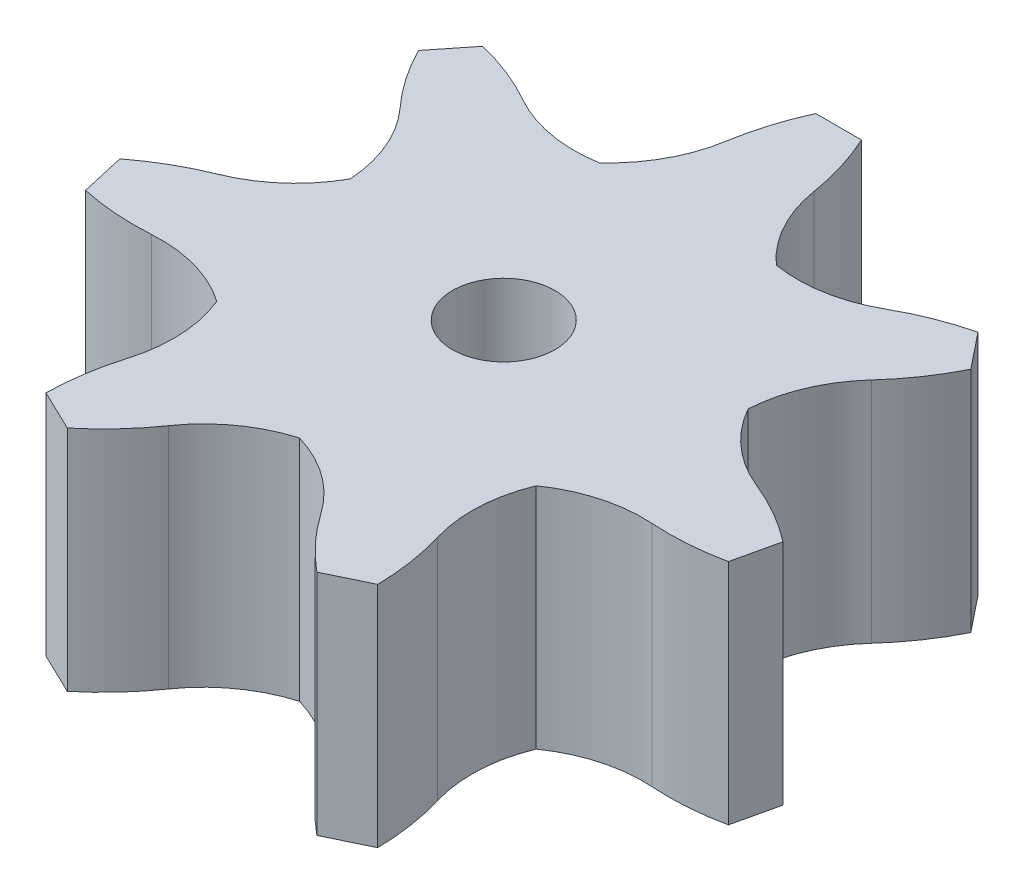
from build123d import *

# Parameters (mm, degrees)
BOSS_EXTRUDE1_DEPTH = 5
CIRPATTERN2_COUNT   = 7
BOSS_EXTRUDE3_DEPTH = 5


with BuildPart() as part:
    # Sketch1 → Boss-Extrude1 (new body)
    with BuildSketch(Plane(origin=(0, 0, 0), x_dir=(1, 0, 0), z_dir=(0, 1, 0))):
        with BuildLine():
            Line((0.5, 7.342689489), (-0.5, 7.342689489))
            ThreePointArc((-0.5, 7.342689489), (-0.952778657, 5.876485931), (-1, 4.342689489))
            Line((-1, 4.342689489), (1, 4.342689489))
            ThreePointArc((1, 4.342689489), (0.952778657, 5.876485931), (0.5, 7.342689489))
        make_face()
        with BuildLine():
            Line((0, 5.842689489), (0.9583076, 5.842689489))
            ThreePointArc((0.9583076, 5.842689489), (1.314078634, 4.820077302), (2, 3.98232997))
            Line((2, 3.98232997), (-2, 3.98232997))
            ThreePointArc((-2, 3.98232997), (-1.314078634, 4.820077302), (-0.9583076, 5.842689489))
            Line((-0.9583076, 5.842689489), (0, 5.842689489))
        make_face()
    boss_extrude1 = extrude(amount=BOSS_EXTRUDE1_DEPTH)

    # CirPattern2: Boss-Extrude1 ×7 about axis
    cirpattern2_axis = Axis((0, 0, 0), (0, 1, 0))
    for i in range(1, CIRPATTERN2_COUNT):
        add(boss_extrude1.rotate(cirpattern2_axis, i * 360 / CIRPATTERN2_COUNT))

    # Sketch1<5> → Boss-Extrude3 (add)
    with BuildSketch(Plane(origin=(0, 0, 0), x_dir=(1, 0, 0), z_dir=(0, 1, 0))):
        with BuildLine():
            ThreePointArc((4.456338407, 0), (3.792863615, 2.339473785), (2, 3.98232997))
            Line((2, 3.98232997), (-2, 3.98232997))
            ThreePointArc((-2, 3.98232997), (-2.339473785, -3.792863615), (4.456338407, 0))
        make_face()
        with BuildLine():
            ThreePointArc((1.125, 0), (0.795495129, -0.795495129), (0, -1.125))
            ThreePointArc((0, -1.125), (-1.125, 0), (0, 1.125))
            ThreePointArc((0, 1.125), (0.795495129, 0.795495129), (1.125, 0))
        make_face(mode=Mode.SUBTRACT)
    extrude(amount=BOSS_EXTRUDE3_DEPTH)


solid = part.part
